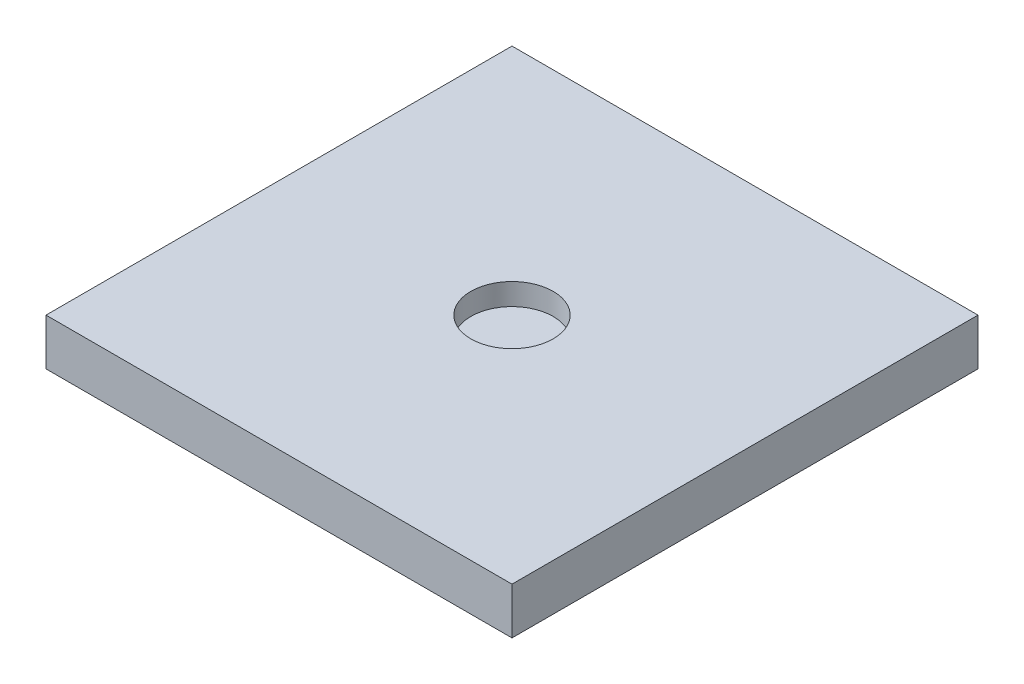
from build123d import *

# Parameters (mm, degrees)
SKETCH1_W           = 150
SKETCH1_H           = 150
SKETCH1_R           = 13.25
BOSS_EXTRUDE1_DEPTH = 15
SKETCH2_R           = 13.25
BOSS_EXTRUDE2_DEPTH = 8


with BuildPart() as part:
    # Sketch1 → Boss-Extrude1 (new body)
    with BuildSketch(Plane(origin=(0, 0, 0), x_dir=(1, 0, 0), z_dir=(0, 1, 0))):
        Rectangle(SKETCH1_W, SKETCH1_H)
        with Locations(Location((0, 0, 0), (0, 0, 270))):
            Circle(SKETCH1_R, mode=Mode.SUBTRACT)
    extrude(amount=BOSS_EXTRUDE1_DEPTH)

    # Sketch2 → Boss-Extrude2 (add)
    with BuildSketch(Plane.XZ):
        with Locations(Location((0, 0, 0), (0, 0, 270))):
            Circle(SKETCH2_R)
    extrude(amount=-BOSS_EXTRUDE2_DEPTH)


solid = part.part
